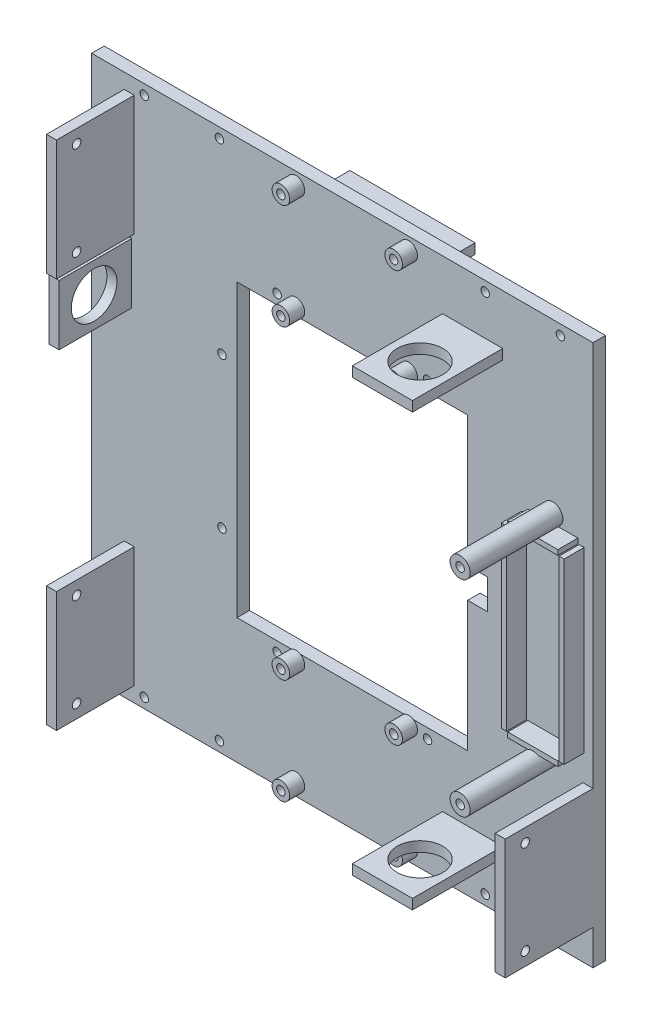
from build123d import *

# Parameters (mm, degrees)
UPPER_DECK_CENTRAL_OPENING_92X116_START       = 52
SKETCH_1_W                                    = 220
SKETCH_1_H                                    = 216
SKETCH_1_W_2                                  = 92
SKETCH_1_H_2                                  = 116
UPPER_DECK_CENTRAL_OPENING_92X116_DEPTH       = 5
EIGHT_MATCHING_M3_CLEARANCE_START             = 58
SKETCH_2_R                                    = 1.7
EIGHT_MATCHING_M3_CLEARANCE_DEPTH             = 7
CAMERA_BASE_TWO_M3_START                      = 58
SKETCH_4_R                                    = 1.7
CAMERA_BASE_TWO_M3_DEPTH                      = 7
UPPER_DECK_REAR_BOX_AND_PIVOT_CLEARANCE_START = 58
SKETCH_5_W                                    = 16
SKETCH_5_H                                    = 220
SKETCH_5_W_2                                  = 8
UPPER_DECK_REAR_BOX_AND_PIVOT_CLEARANCE_DEPTH = 7
BATTERY_CLAMP_VERTICAL_TOOL_ACCESS_DEPTH      = 70
BATTERY_CLAMP_VERTICAL_TOOL_ACCESS_DEPTH_BACK = 70
SKETCH_6_W                                    = 11
SKETCH_6_H                                    = 12
INTEGRAL_DRIVER_STANDOFFS_6MM_START           = 57
SKETCH_7_R                                    = 3.5
INTEGRAL_DRIVER_STANDOFFS_6MM_DEPTH           = 6
ELECTRONICS_MATCHING_DECK_HOLES_START         = 64
SKETCH_8_R                                    = 1.7
ELECTRONICS_MATCHING_DECK_HOLES_DEPTH         = 13
CONTROL_BATTERY_LOW_LOCATORS_START            = 57
SKETCH_9_W                                    = 2
SKETCH_9_H                                    = 71
SKETCH_9_W_2                                  = 20
SKETCH_9_H_2                                  = 2
CONTROL_BATTERY_LOW_LOCATORS_DEPTH            = 8
CONTROL_BATTERY_INTEGRAL_CLAMP_POSTS_START    = 57
SKETCH_10_R                                   = 4
CONTROL_BATTERY_INTEGRAL_CLAMP_POSTS_DEPTH    = 37
CONTROL_BATTERY_M3_THROUGH_START              = 95
SKETCH_11_R                                   = 1.7
CONTROL_BATTERY_M3_THROUGH_DEPTH              = 44
SIDE_IR_DIRECT_UNDERDECK_MOUNTS_START         = 33
SKETCH_12_W                                   = 50
SKETCH_12_H                                   = 4
SIDE_IR_DIRECT_UNDERDECK_MOUNTS_DEPTH         = 19
SIDE_IR_37P4_PITCH_DEPTH                      = 110
SIDE_IR_37P4_PITCH_DEPTH_BACK                 = 110
SKETCH_13_R                                   = 1.7
FRONT_IR_DIRECT_UPPER_MOUNTS_START            = 57
SKETCH_14_W                                   = 4
SKETCH_14_H                                   = 48
FRONT_IR_DIRECT_UPPER_MOUNTS_DEPTH            = 31
FRONT_IR_M3_MOUNTS_START                      = -87
SKETCH_15_R                                   = 1.7
FRONT_IR_M3_MOUNTS_DEPTH                      = 4
REAR_IR_ABOVE_TAIL_NOT_ON_RAMP_START          = 57
SKETCH_16_W                                   = 4
SKETCH_16_H                                   = 48
REAR_IR_ABOVE_TAIL_NOT_ON_RAMP_DEPTH          = 35
REAR_IR_M3_MOUNTS_START                       = 96
SKETCH_17_R                                   = 1.7
REAR_IR_M3_MOUNTS_DEPTH                       = 4
FRONT_PHOTOEYE_SHORT_DIRECT_SEAT_START        = 57
SKETCH_18_W                                   = 4
SKETCH_18_H                                   = 24
FRONT_PHOTOEYE_SHORT_DIRECT_SEAT_DEPTH        = 29
FRONT_M18_CLEARANCE_START                     = -88
SKETCH_19_R                                   = 9.1
FRONT_M18_CLEARANCE_DEPTH                     = 4
SIDE_PHOTOEYE_DIRECT_SEATS_START              = 57
SKETCH_20_W                                   = 24
SKETCH_20_H                                   = 4
SIDE_PHOTOEYE_DIRECT_SEATS_DEPTH              = 36
SIDE_M18_CLEARANCES_DEPTH                     = 110
SIDE_M18_CLEARANCES_DEPTH_BACK                = 110
SKETCH_21_R                                   = 9.1


with BuildPart() as part:
    # 草图1 → Upper_deck_central_opening_92x116 (new body)
    with BuildSketch(Plane.XY.offset(UPPER_DECK_CENTRAL_OPENING_92X116_START)):
        Rectangle(SKETCH_1_W, SKETCH_1_H)
        Rectangle(SKETCH_1_W_2, SKETCH_1_H_2, mode=Mode.SUBTRACT)
    extrude(amount=UPPER_DECK_CENTRAL_OPENING_92X116_DEPTH)

    # 草图2 → Eight_matching_M3_clearance (cut)
    with BuildSketch(Plane.XY.offset(EIGHT_MATCHING_M3_CLEARANCE_START)):
        with Locations(Location((-83, -104, 0), (0, 0, 180))):
            Circle(SKETCH_2_R)
        with Locations(Location((-83, 104, 0), (0, 0, 180))):
            Circle(SKETCH_2_R)
        with Locations(Location((-53, -104, 0), (0, 0, 180))):
            Circle(SKETCH_2_R)
        with Locations(Location((-53, 104, 0), (0, 0, 180))):
            Circle(SKETCH_2_R)
        with Locations(Location((53, -104, 0), (0, 0, 180))):
            Circle(SKETCH_2_R)
        with Locations(Location((53, 104, 0), (0, 0, 180))):
            Circle(SKETCH_2_R)
        with Locations(Location((83, -104, 0), (0, 0, 180))):
            Circle(SKETCH_2_R)
        with Locations(Location((83, 104, 0), (0, 0, 180))):
            Circle(SKETCH_2_R)
    extrude(amount=-EIGHT_MATCHING_M3_CLEARANCE_DEPTH, mode=Mode.SUBTRACT)

    # 草图4 → Camera_base_two_M3 (cut)
    with BuildSketch(Plane.XY.offset(CAMERA_BASE_TWO_M3_START)):
        with Locations(Location((-52, -30, 0), (0, 0, 180))):
            Circle(SKETCH_4_R)
        with Locations(Location((-52, 30, 0), (0, 0, 180))):
            Circle(SKETCH_4_R)
    extrude(amount=-CAMERA_BASE_TWO_M3_DEPTH, mode=Mode.SUBTRACT)

    # 草图5 → Upper_deck_rear_box_and_pivot_clearance (cut)
    with BuildSketch(Plane.XY.offset(UPPER_DECK_REAR_BOX_AND_PIVOT_CLEARANCE_START)):
        with Locations((104, 0)):
            Rectangle(SKETCH_5_W, SKETCH_5_H)
        with Locations((-108, 0)):
            Rectangle(SKETCH_5_W_2, SKETCH_5_H)
    extrude(amount=-UPPER_DECK_REAR_BOX_AND_PIVOT_CLEARANCE_DEPTH, mode=Mode.SUBTRACT)

    # 草图6 → Battery_clamp_vertical_tool_access (cut, two sides: drawn at the far end of the back side and taken through both)
    with BuildSketch(Plane.XY.offset(-BATTERY_CLAMP_VERTICAL_TOOL_ACCESS_DEPTH_BACK)):
        with Locations((48.5, 0)):
            Rectangle(SKETCH_6_W, SKETCH_6_H)
    extrude(amount=BATTERY_CLAMP_VERTICAL_TOOL_ACCESS_DEPTH + BATTERY_CLAMP_VERTICAL_TOOL_ACCESS_DEPTH_BACK, mode=Mode.SUBTRACT)

    # 草图7 → Integral_driver_standoffs_6mm (add)
    with BuildSketch(Plane.XY.offset(INTEGRAL_DRIVER_STANDOFFS_6MM_START)):
        with Locations(Location((-22.5, -103, 0), (0, 0, 180))):
            Circle(SKETCH_7_R)
        with Locations(Location((-22.5, -61, 0), (0, 0, 121.002719134))):
            Circle(SKETCH_7_R)
        with Locations(Location((22.5, -103, 0), (0, 0, 180))):
            Circle(SKETCH_7_R)
        with Locations(Location((22.5, -61, 0), (0, 0, 121.002719134))):
            Circle(SKETCH_7_R)
        with Locations(Location((-22.5, 61, 0), (0, 0, 238.997280866))):
            Circle(SKETCH_7_R)
        with Locations(Location((-22.5, 103, 0), (0, 0, 180))):
            Circle(SKETCH_7_R)
        with Locations(Location((22.5, 61, 0), (0, 0, 238.997280866))):
            Circle(SKETCH_7_R)
        with Locations(Location((22.5, 103, 0), (0, 0, 180))):
            Circle(SKETCH_7_R)
    extrude(amount=INTEGRAL_DRIVER_STANDOFFS_6MM_DEPTH)

    # 草图8 → Electronics_matching_deck_holes (cut)
    with BuildSketch(Plane.XY.offset(ELECTRONICS_MATCHING_DECK_HOLES_START)):
        with Locations((-22.5, -103)):
            Circle(SKETCH_8_R)
        with Locations((-22.5, -61)):
            Circle(SKETCH_8_R)
        with Locations((22.5, -103)):
            Circle(SKETCH_8_R)
        with Locations((22.5, -61)):
            Circle(SKETCH_8_R)
        with Locations((-22.5, 61)):
            Circle(SKETCH_8_R)
        with Locations((-22.5, 103)):
            Circle(SKETCH_8_R)
        with Locations((22.5, 61)):
            Circle(SKETCH_8_R)
        with Locations((22.5, 103)):
            Circle(SKETCH_8_R)
        with Locations((-30, -62)):
            Circle(SKETCH_8_R)
        with Locations((-30, 62)):
            Circle(SKETCH_8_R)
        with Locations((30, -62)):
            Circle(SKETCH_8_R)
        with Locations((30, 62)):
            Circle(SKETCH_8_R)
    extrude(amount=-ELECTRONICS_MATCHING_DECK_HOLES_DEPTH, mode=Mode.SUBTRACT)

    # 草图9 → Control_battery_low_locators (add)
    with BuildSketch(Plane.XY.offset(CONTROL_BATTERY_LOW_LOCATORS_START)):
        with Locations((68.5, 0)):
            Rectangle(SKETCH_9_W, SKETCH_9_H)
        with Locations((91.5, 0)):
            Rectangle(SKETCH_9_W, SKETCH_9_H)
        with Locations((80, -36.5)):
            Rectangle(SKETCH_9_W_2, SKETCH_9_H_2)
        with Locations((80, 36.5)):
            Rectangle(SKETCH_9_W_2, SKETCH_9_H_2)
    extrude(amount=CONTROL_BATTERY_LOW_LOCATORS_DEPTH)

    # 草图10 → Control_battery_integral_clamp_posts (add)
    with BuildSketch(Plane.XY.offset(CONTROL_BATTERY_INTEGRAL_CLAMP_POSTS_START)):
        with Locations(Location((80, -41, 0), (0, 0, 118.955024372))):
            Circle(SKETCH_10_R)
        with Locations(Location((80, 41, 0), (0, 0, 241.044975628))):
            Circle(SKETCH_10_R)
    extrude(amount=CONTROL_BATTERY_INTEGRAL_CLAMP_POSTS_DEPTH)

    # 草图11 → Control_battery_M3_through (cut)
    with BuildSketch(Plane.XY.offset(CONTROL_BATTERY_M3_THROUGH_START)):
        with Locations((80, -41)):
            Circle(SKETCH_11_R)
        with Locations((80, 41)):
            Circle(SKETCH_11_R)
    extrude(amount=-CONTROL_BATTERY_M3_THROUGH_DEPTH, mode=Mode.SUBTRACT)

    # 草图12 → Side_IR_direct_underdeck_mounts (add)
    with BuildSketch(Plane.XY.offset(SIDE_IR_DIRECT_UNDERDECK_MOUNTS_START)):
        with Locations((0, 93)):
            Rectangle(SKETCH_12_W, SKETCH_12_H)
        with Locations((0, -93)):
            Rectangle(SKETCH_12_W, SKETCH_12_H)
    extrude(amount=SIDE_IR_DIRECT_UNDERDECK_MOUNTS_DEPTH)

    # 草图13 → Side_IR_37p4_pitch (cut, two sides: drawn at the far end of the back side and taken through both)
    with BuildSketch(Plane(origin=(0, 0, 0), x_dir=(1, 0, 0), z_dir=(0, 1, 0)).offset(-SIDE_IR_37P4_PITCH_DEPTH_BACK)):
        with Locations(Location((-18.7, -44, 0), (0, 0, 90))):
            Circle(SKETCH_13_R)
        with Locations(Location((18.7, -44, 0), (0, 0, 90))):
            Circle(SKETCH_13_R)
    extrude(amount=SIDE_IR_37P4_PITCH_DEPTH + SIDE_IR_37P4_PITCH_DEPTH_BACK, mode=Mode.SUBTRACT)

    # 草图14 → Front_IR_direct_upper_mounts (add)
    with BuildSketch(Plane.XY.offset(FRONT_IR_DIRECT_UPPER_MOUNTS_START)):
        with Locations((-89, -78)):
            Rectangle(SKETCH_14_W, SKETCH_14_H)
        with Locations((-89, 78)):
            Rectangle(SKETCH_14_W, SKETCH_14_H)
    extrude(amount=FRONT_IR_DIRECT_UPPER_MOUNTS_DEPTH)

    # 草图15 → Front_IR_M3_mounts (cut)
    with BuildSketch(Plane(origin=(0, 0, 0), x_dir=(0, 0, -1), z_dir=(1, 0, 0)).offset(FRONT_IR_M3_MOUNTS_START)):
        with Locations((-80, -96.7)):
            Circle(SKETCH_15_R)
        with Locations((-80, -59.3)):
            Circle(SKETCH_15_R)
        with Locations((-80, 59.3)):
            Circle(SKETCH_15_R)
        with Locations((-80, 96.7)):
            Circle(SKETCH_15_R)
    extrude(amount=-FRONT_IR_M3_MOUNTS_DEPTH, mode=Mode.SUBTRACT)

    # 草图16 → Rear_IR_above_tail_not_on_ramp (add)
    with BuildSketch(Plane.XY.offset(REAR_IR_ABOVE_TAIL_NOT_ON_RAMP_START)):
        with Locations((94, -70)):
            Rectangle(SKETCH_16_W, SKETCH_16_H)
    extrude(amount=REAR_IR_ABOVE_TAIL_NOT_ON_RAMP_DEPTH)

    # 草图17 → Rear_IR_M3_mounts (cut)
    with BuildSketch(Plane(origin=(0, 0, 0), x_dir=(0, 0, -1), z_dir=(1, 0, 0)).offset(REAR_IR_M3_MOUNTS_START)):
        with Locations((-84, -88.7)):
            Circle(SKETCH_17_R)
        with Locations((-84, -51.3)):
            Circle(SKETCH_17_R)
    extrude(amount=-REAR_IR_M3_MOUNTS_DEPTH, mode=Mode.SUBTRACT)

    # 草图18 → Front_photoeye_short_direct_seat (add)
    with BuildSketch(Plane.XY.offset(FRONT_PHOTOEYE_SHORT_DIRECT_SEAT_START)):
        with Locations((-90, 40)):
            Rectangle(SKETCH_18_W, SKETCH_18_H)
    extrude(amount=FRONT_PHOTOEYE_SHORT_DIRECT_SEAT_DEPTH)

    # 草图19 → Front_M18_clearance (cut)
    with BuildSketch(Plane(origin=(0, 0, 0), x_dir=(0, 0, -1), z_dir=(1, 0, 0)).offset(FRONT_M18_CLEARANCE_START)):
        with Locations((-72, 40)):
            Circle(SKETCH_19_R)
    extrude(amount=-FRONT_M18_CLEARANCE_DEPTH, mode=Mode.SUBTRACT)

    # 草图20 → Side_photoeye_direct_seats (add)
    with BuildSketch(Plane.XY.offset(SIDE_PHOTOEYE_DIRECT_SEATS_START)):
        with Locations((48, 86)):
            Rectangle(SKETCH_20_W, SKETCH_20_H)
        with Locations((48, -86)):
            Rectangle(SKETCH_20_W, SKETCH_20_H)
    extrude(amount=SIDE_PHOTOEYE_DIRECT_SEATS_DEPTH)

    # 草图21 → Side_M18_clearances (cut, two sides: drawn at the far end of the back side and taken through both)
    with BuildSketch(Plane(origin=(0, 0, 0), x_dir=(1, 0, 0), z_dir=(0, 1, 0)).offset(-SIDE_M18_CLEARANCES_DEPTH_BACK)):
        with Locations(Location((48, -78, 0), (0, 0, 90))):
            Circle(SKETCH_21_R)
    extrude(amount=SIDE_M18_CLEARANCES_DEPTH + SIDE_M18_CLEARANCES_DEPTH_BACK, mode=Mode.SUBTRACT)


solid = part.part
